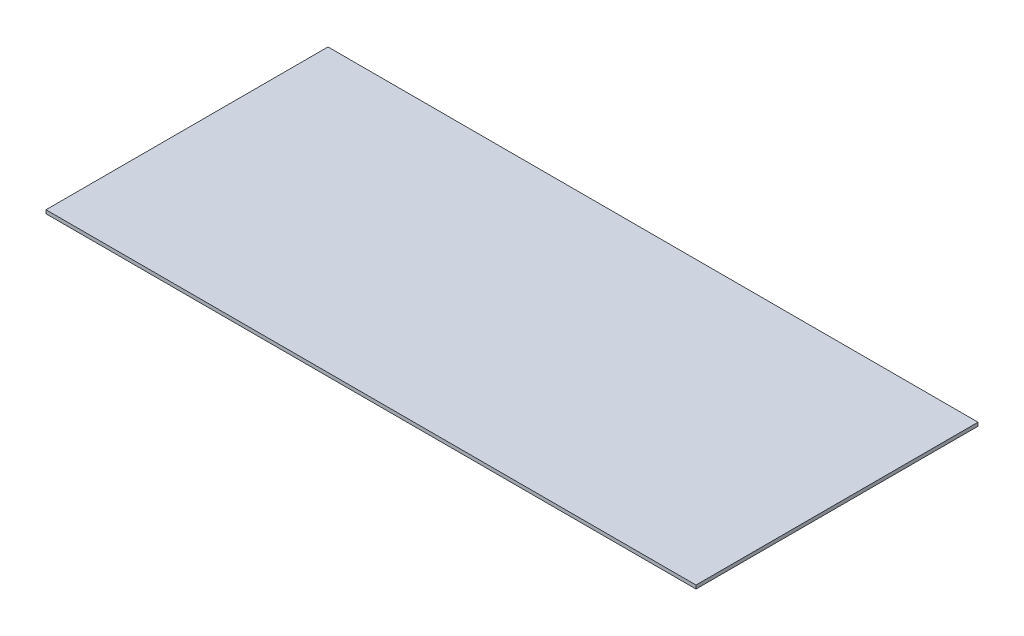
from build123d import *

# Parameters (mm, degrees)
CROQUIS1_W     = 922
CROQUIS1_H     = 400
EXTRUIR1_DEPTH = 5


with BuildPart() as part:
    # Croquis1 → Extruir1 (new body)
    with BuildSketch(Plane(origin=(0, 0, 0), x_dir=(1, 0, 0), z_dir=(0, 1, 0))):
        Rectangle(CROQUIS1_W, CROQUIS1_H)
    extrude(amount=EXTRUIR1_DEPTH)


solid = part.part
